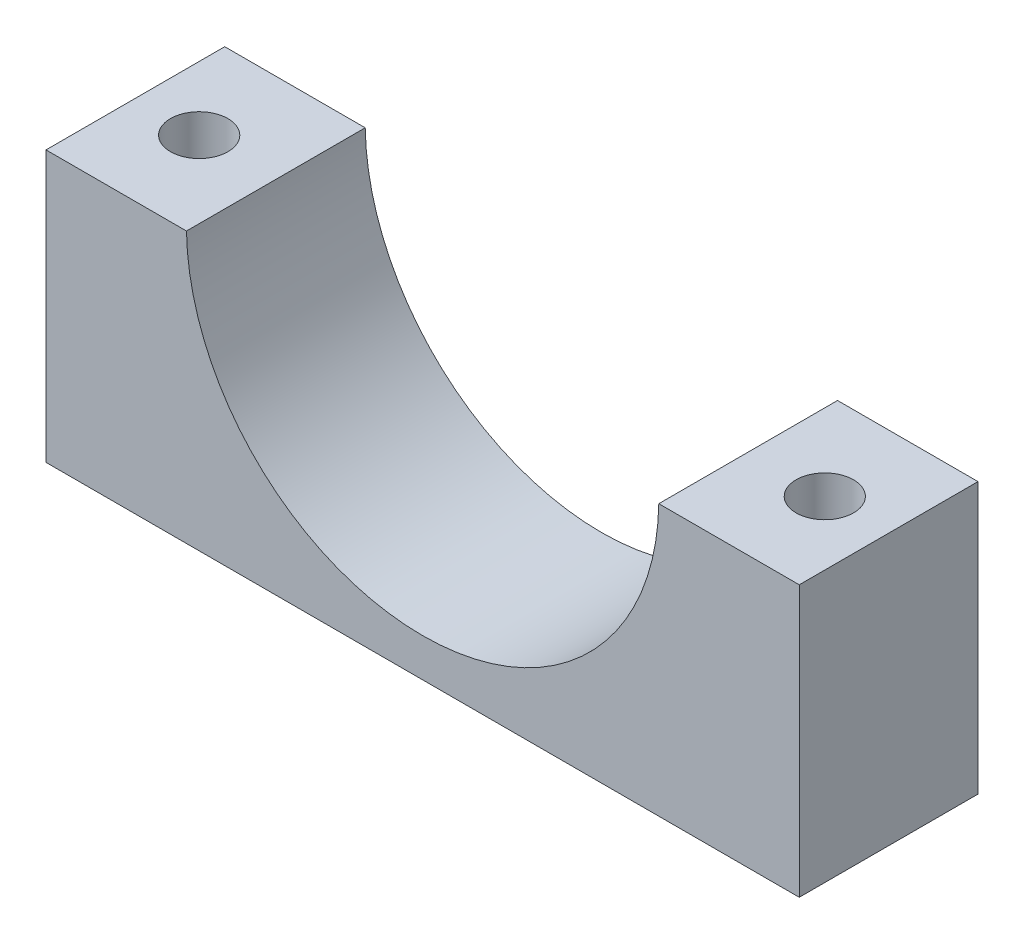
from build123d import *

# Parameters (mm, degrees)
SPLIT_SADDLE_WITH_37_0_MM_PROTOTYPE_BORE_DEPTH = 14
M4_THROUGH_HOLES_DEPTH                         = 44.144988121
M4_THROUGH_HOLES_DEPTH_BACK                    = 44.144988121
SKETCH2_R                                      = 2.25


with BuildPart() as part:
    # Split saddle with 37.0 mm prototype  2 → Split saddle with 37.0 mm prototype bore (new body)
    with BuildSketch(Plane.XY):
        with BuildLine():
            Line((-29.5, 7), (29.5, 7))
            Line((29.5, 7), (29.5, 28.2))
            Line((29.5, 28.2), (18.497567408, 28.2))
            ThreePointArc((18.497567408, 28.2), (0, 10), (-18.497567408, 28.2))
            Line((-18.497567408, 28.2), (-29.5, 28.2))
            Line((-29.5, 28.2), (-29.5, 7))
        make_face()
    extrude(amount=SPLIT_SADDLE_WITH_37_0_MM_PROTOTYPE_BORE_DEPTH)

    # Sketch2 → M4 through holes (cut, two sides: drawn at the far end of the back side and taken through both)
    with BuildSketch(Plane(origin=(0, 0, 0), x_dir=(1, 0, 0), z_dir=(0, 1, 0)).offset(-M4_THROUGH_HOLES_DEPTH_BACK)):
        with Locations(Location((-24.5, -7, 0), (0, 0, 270))):
            Circle(SKETCH2_R)
        with Locations(Location((24.5, -7, 0), (0, 0, 270))):
            Circle(SKETCH2_R)
    extrude(amount=M4_THROUGH_HOLES_DEPTH + M4_THROUGH_HOLES_DEPTH_BACK, mode=Mode.SUBTRACT)


solid = part.part
